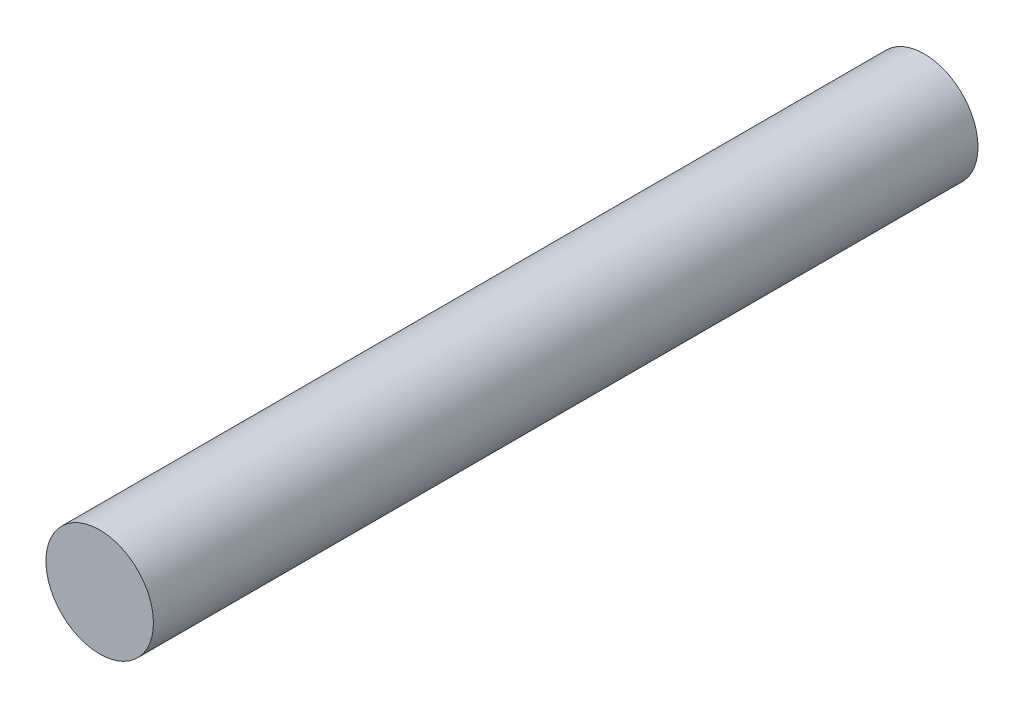
from build123d import *

# Parameters (mm, degrees)
SKETCH1_R           = 15
BOSS_EXTRUDE1_DEPTH = 230


with BuildPart() as part:
    # Sketch1 → Boss-Extrude1 (new body)
    with BuildSketch(Plane.XY):
        Circle(SKETCH1_R)
    extrude(amount=BOSS_EXTRUDE1_DEPTH)


solid = part.part
